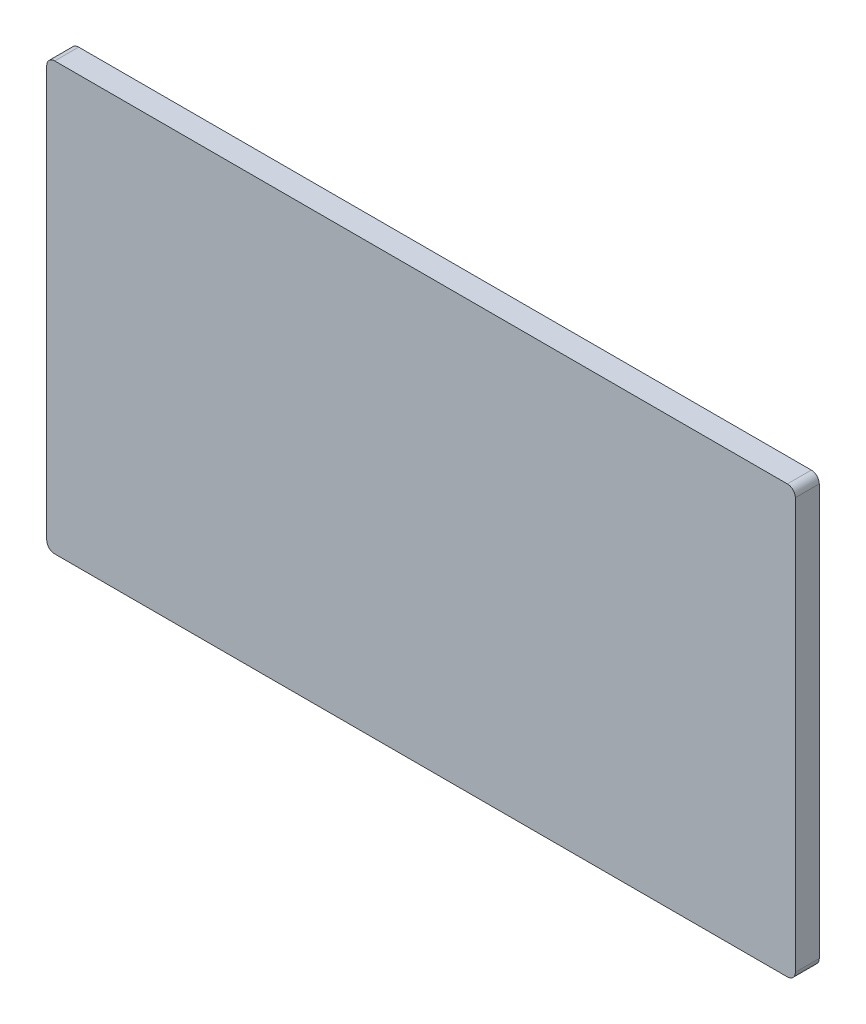
from build123d import *

# Parameters (mm, degrees)
SKETCH1_W           = 93.8
SKETCH1_H           = 53.5
BOSS_EXTRUDE1_DEPTH = 3
FILLET1_R           = 1


with BuildPart() as part:
    # Sketch1 → Boss-Extrude1 (new body)
    with BuildSketch(Plane.XY):
        Rectangle(SKETCH1_W, SKETCH1_H)
    extrude(amount=BOSS_EXTRUDE1_DEPTH)

    # Fillet1
    fillet1_edges = [part.edges().sort_by_distance(p)[0] for p in [
        (46.9, -26.75, 1.5),
        (-46.9, -26.75, 1.5),
        (-46.9, 26.75, 1.5),
        (46.9, 26.75, 1.5),
    ]]
    fillet(fillet1_edges, radius=FILLET1_R)


solid = part.part
